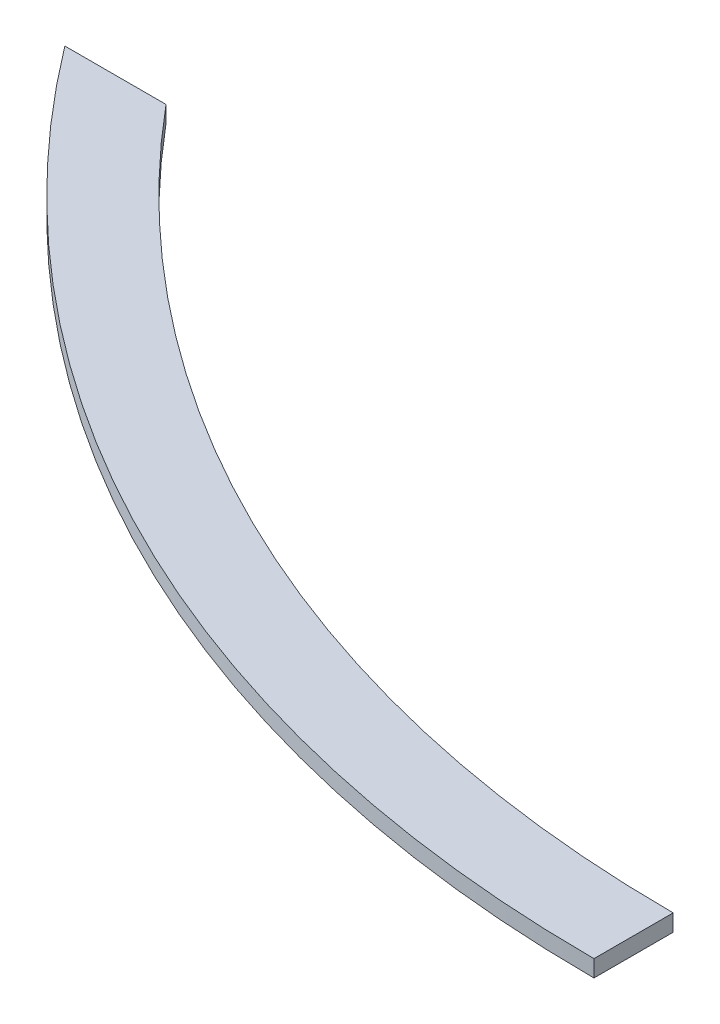
from build123d import *

# Parameters (mm, degrees)
BOSS_EXTRUDE1_DEPTH = 6.35
SKETCH3_W           = 30
SKETCH3_H           = 6.35
BOSS_EXTRUDE2_DEPTH = 80


with BuildPart() as part:
    # Sketch2 → Boss-Extrude1 (new body)
    with BuildSketch(Plane(origin=(0, 0, 0), x_dir=(1, 0, 0), z_dir=(0, 1, 0))):
        with BuildLine():
            ThreePointArc((0, -470), (-332.340187158, -332.340187158), (-470, 0))
            Line((-470, 0), (-500, 0))
            ThreePointArc((-500, 0), (-353.553390593, -353.553390593), (0, -500))
            Line((0, -500), (0, -470))
        make_face()
    extrude(amount=BOSS_EXTRUDE1_DEPTH)

    # Sketch3 → Boss-Extrude2 (add)
    with BuildSketch(Plane(origin=(0, 0, 0), x_dir=(-1, 0, 0), z_dir=(0, 0, -1))):
        with Locations((485, 3.175)):
            Rectangle(SKETCH3_W, SKETCH3_H)
    extrude(amount=BOSS_EXTRUDE2_DEPTH)

    # Split1
    split(bisect_by=Plane(origin=(0, 0, 301), x_dir=(-1, 0, 0), z_dir=(0, 0, -1)), keep=Keep.BOTTOM)


solid = part.part
